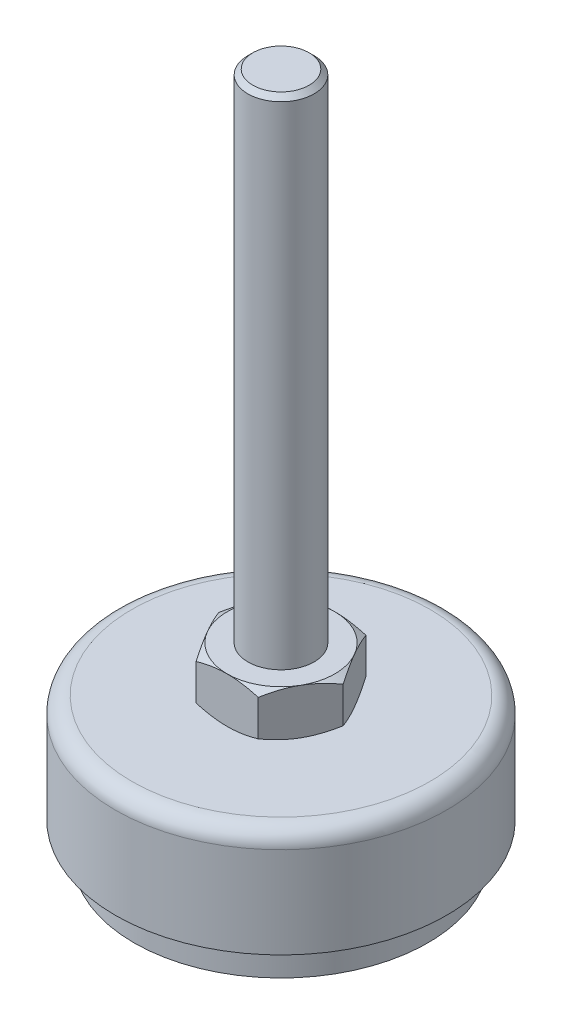
from build123d import *

# Parameters (mm, degrees)
BOSS_EXTRUDE1_START = -60
BOSS_EXTRUDE1_DEPTH = 5.5


with BuildPart() as part:
    # Sketch1 → Revolve1 (revolve)
    with BuildSketch(Plane.XY):
        with BuildLine():
            Line((-17.75, 0), (0, 0))
            Line((0, 0), (0, 82.5))
            Line((0, 82.5), (-3.4, 82.5))
            Line((-3.4, 82.5), (-4, 81.9))
            Line((-4, 81.9), (-4, 17))
            Line((-4, 17), (-18, 17))
            ThreePointArc((-18, 17), (-19.414213562, 16.414213562), (-20, 15))
            Line((-20, 15), (-20, 4))
            Line((-20, 4), (-17.75, 4))
            Line((-17.75, 4), (-17.75, 0))
        make_face()
    revolve(axis=Axis((0, 86.625, 0), (0, -1, 0)))

    # Sketch2 → Boss-Extrude1 (add)
    with BuildSketch(Plane(origin=(0, 82.5, 0), x_dir=(0, 0, -1), z_dir=(0, 1, 0)).offset(BOSS_EXTRUDE1_START)):
        Polygon((6.5, -3.75277675), (6.5, 3.75277675), (0, 7.505553499), (-6.5, 3.75277675), (-6.5, -3.75277675), (0, -7.505553499), align=None)
    extrude(amount=-BOSS_EXTRUDE1_DEPTH)

    # Sketch3 → Cut-Revolve1 (revolve, cut)
    with BuildSketch(Plane.XY):
        Polygon((7.505553499, 22.5), (6.5, 22.5), (7.505553499, 21.919443416), align=None)
        Polygon((7.505553499, 17), (6.5, 17), (7.505553499, 17.580556584), align=None)
    revolve(axis=Axis((0, 86.625, 0), (0, -1, 0)), mode=Mode.SUBTRACT)


solid = part.part
